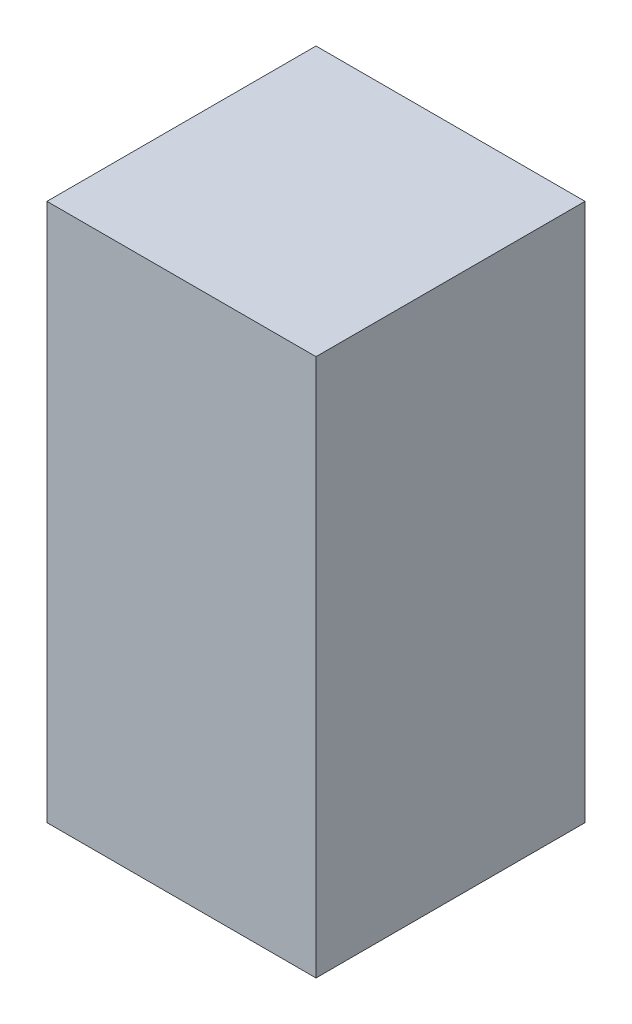
from build123d import *

# Parameters (mm, degrees)
SKETCH1_W           = 300
SKETCH1_H           = 300
BOSS_EXTRUDE1_DEPTH = 600
SKETCH2_R           = 142.6010694
CUT_EXTRUDE1_DEPTH  = 142.6
REVOLVE1_ANGLE      = 180


with BuildPart() as part:
    # Sketch1 → Boss-Extrude1 (new body)
    with BuildSketch(Plane(origin=(0, 0, 0), x_dir=(1, 0, 0), z_dir=(0, 1, 0))):
        Rectangle(SKETCH1_W, SKETCH1_H)
    extrude(amount=BOSS_EXTRUDE1_DEPTH)

    # Sketch2 → Cut-Extrude1 (cut)
    with BuildSketch(Plane.XZ):
        with Locations(Location((0, 0, 0), (0, 0, 270))):
            Circle(SKETCH2_R)
    extrude(amount=-CUT_EXTRUDE1_DEPTH, mode=Mode.SUBTRACT)

    # Sketch3 → Revolve1 (revolve)
    with BuildSketch(Plane.XZ.offset(-142.6)):
        with BuildLine():
            Line((0, 142.601069387), (0, -142.601069387))
            ThreePointArc((0, -142.601069387), (-142.601069387, 0), (0, 142.601069387))
        make_face()
    revolve(axis=Axis((0, 142.6, 142.601069387), (0, 0, 1)), revolution_arc=REVOLVE1_ANGLE)


solid = part.part
